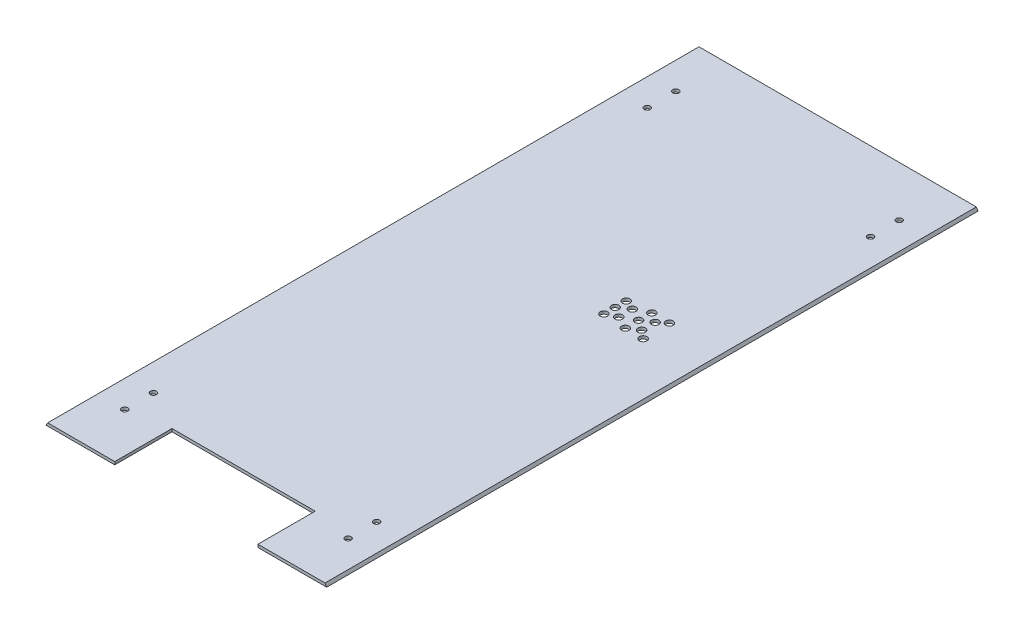
from build123d import *

# Parameters (mm, degrees)
EXTRUDE_1_DEPTH     = 455
SKETCH_3_R          = 2.1
CUT_EXTRUDE_1_DEPTH = 466.453246739
SKETCH_4_W          = 100
SKETCH_4_H          = 40
CUT_EXTRUDE_2_DEPTH = 466.453246739
SKETCH_5_R          = 2.605282574
CUT_EXTRUDE_3_DEPTH = 466.453246739


with BuildPart() as part:
    # 草图2 → 凸台-拉伸1 (new body)
    with BuildSketch(Plane.XY):
        Polygon((-98, -1), (-96.845299462, 1), (96.915299462, 1), (98.07, -1), align=None)
    extrude(amount=-EXTRUDE_1_DEPTH)

    # 草图3 → 切除-拉伸1 (cut, through all)
    with BuildSketch(Plane(origin=(0, -1, 0), x_dir=(-1, 0, 0), z_dir=(0, -1, 0))):
        with Locations(Location((78, 35, 0), (0, 0, 90))):
            Circle(SKETCH_3_R)
        with Locations(Location((78, 55, 0), (0, 0, 90))):
            Circle(SKETCH_3_R)
        with Locations(Location((-78, 55, 0), (0, 0, 270))):
            Circle(SKETCH_3_R)
        with Locations(Location((-78, 35, 0), (0, 0, 270))):
            Circle(SKETCH_3_R)
        with Locations(Location((-78, 420, 0), (0, 0, 90))):
            Circle(SKETCH_3_R)
        with Locations(Location((-78, 400, 0), (0, 0, 90))):
            Circle(SKETCH_3_R)
        with Locations(Location((78, 400, 0), (0, 0, 270))):
            Circle(SKETCH_3_R)
        with Locations(Location((78, 420, 0), (0, 0, 270))):
            Circle(SKETCH_3_R)
    extrude(amount=-CUT_EXTRUDE_1_DEPTH, mode=Mode.SUBTRACT)

    # 草图4 → 切除-拉伸2 (cut, through all)
    with BuildSketch(Plane.XZ.offset(1)):
        with Locations((0.035, -20)):
            Rectangle(SKETCH_4_W, SKETCH_4_H)
    extrude(amount=-CUT_EXTRUDE_2_DEPTH, mode=Mode.SUBTRACT)

    # 草图5 → 切除-拉伸3 (cut, through all)
    with BuildSketch(Plane.XZ.offset(1)):
        with Locations(Location((31.560145964, -260.175968549, 0), (0, 0, 270))):
            Circle(SKETCH_5_R)
        with Locations(Location((31.560145964, -268.040513613, 0), (0, 0, 270))):
            Circle(SKETCH_5_R)
        with Locations(Location((31.560145964, -275.759418954, 0), (0, 0, 270))):
            Circle(SKETCH_5_R)
        with Locations(Location((38.591431537, -263.539657654, 0), (0, 0, 270))):
            Circle(SKETCH_5_R)
        with Locations(Location((38.591431537, -273.011612977, 0), (0, 0, 270))):
            Circle(SKETCH_5_R)
        with Locations(Location((47.527390385, -268.469499033, 0), (0, 0, 270))):
            Circle(SKETCH_5_R)
        with Locations(Location((54.534326635, -263.539657654, 0), (0, 0, 270))):
            Circle(SKETCH_5_R)
        with Locations(Location((54.534326635, -273.011612977, 0), (0, 0, 270))):
            Circle(SKETCH_5_R)
        with Locations(Location((47.688259917, -277.526130321, 0), (0, 0, 270))):
            Circle(SKETCH_5_R)
        with Locations(Location((47.688259917, -259.038134333, 0), (0, 0, 270))):
            Circle(SKETCH_5_R)
        with Locations(Location((60.308400403, -258.8772648, 0), (0, 0, 270))):
            Circle(SKETCH_5_R)
        with Locations(Location((59.986661338, -277.526130321, 0), (0, 0, 270))):
            Circle(SKETCH_5_R)
    extrude(amount=-CUT_EXTRUDE_3_DEPTH, mode=Mode.SUBTRACT)


solid = part.part
